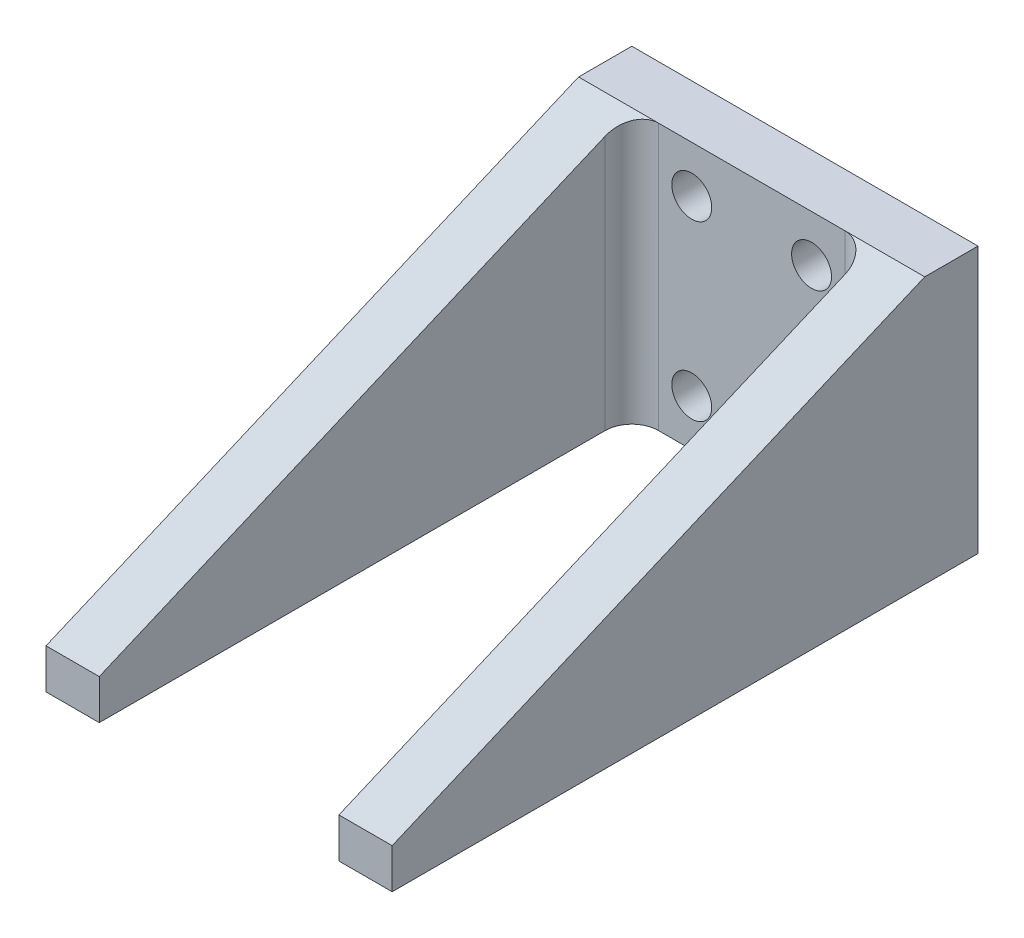
from build123d import *

# Parameters (mm, degrees)
SKETCH_1_W          = 26
SKETCH_1_H          = 20
EXTRUDE_1_DEPTH     = 4
SKETCH_2_W          = 4
SKETCH_2_H          = 20
EXTRUDE_2_DEPTH     = 40
SKETCH_3_R          = 1.5
CUT_EXTRUDE_1_DEPTH = 30
CUT_EXTRUDE_2_DEPTH = 53.076866265
FILLET_1_R          = 2


with BuildPart() as part:
    # 草图1 → 凸台-拉伸1 (new body)
    with BuildSketch(Plane.XY):
        Rectangle(SKETCH_1_W, SKETCH_1_H)
    extrude(amount=EXTRUDE_1_DEPTH)

    # 草图2 → 凸台-拉伸2 (add)
    with BuildSketch(Plane.XY.offset(4)):
        with Locations((-11, 0)):
            Rectangle(SKETCH_2_W, SKETCH_2_H)
        with Locations((11, 0)):
            Rectangle(SKETCH_2_W, SKETCH_2_H)
    extrude(amount=EXTRUDE_2_DEPTH)

    # 草图3 → 切除-拉伸1 (cut)
    with BuildSketch(Plane.XY.offset(4)):
        with Locations((-4.5, 6.5)):
            Circle(SKETCH_3_R)
        with Locations((4.5, 6.5)):
            Circle(SKETCH_3_R)
        with Locations((4.5, -6.5)):
            Circle(SKETCH_3_R)
        with Locations((-4.5, -6.5)):
            Circle(SKETCH_3_R)
    extrude(amount=-CUT_EXTRUDE_1_DEPTH, mode=Mode.SUBTRACT)

    # 草图4 → 切除-拉伸2 (cut, through all)
    with BuildSketch(Plane(origin=(13, 0, 0), x_dir=(0, 0, -1), z_dir=(1, 0, 0))):
        Polygon((-44, -7), (-4, 10), (-44, 10), align=None)
    extrude(amount=-CUT_EXTRUDE_2_DEPTH, mode=Mode.SUBTRACT)

    # 圆角1
    fillet_1_edges = [part.edges().sort_by_distance(p)[0] for p in [
        (-9, 0, 4),
        (9, 0, 4),
    ]]
    fillet(fillet_1_edges, radius=FILLET_1_R)


solid = part.part
